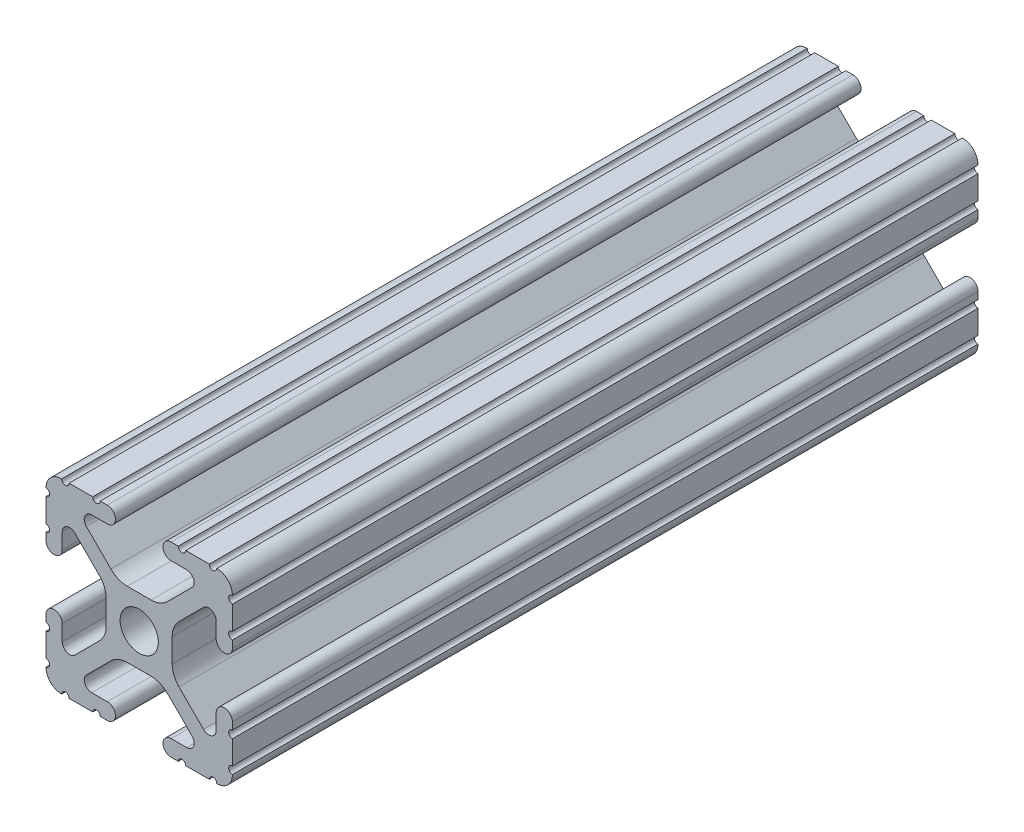
from build123d import *

# Parameters (mm, degrees)
SKETCH1_R           = 2.6035
BOSS_EXTRUDE1_DEPTH = 101.6


with BuildPart() as part:
    # Sketch1 → Boss-Extrude1 (new body)
    with BuildSketch(Plane(origin=(0, 0, -2463.8), x_dir=(-1, 0, 0), z_dir=(0, 0, -1))):
        with BuildLine():
            Line((12.7, -9.5504), (12.7, -6.3330836))
            ThreePointArc((12.7, -6.3330836), (12.192, -5.8250836), (12.7, -5.3170836))
            Line((12.7, -5.3170836), (12.7, -4.3434))
            ThreePointArc((12.7, -4.3434), (11.5951, -3.2385), (10.4902, -4.3434))
            Line((10.4902, -4.3434), (10.4902, -6.474794456))
            ThreePointArc((10.4902, -6.474794456), (9.863006367, -7.413456061), (8.75577951, -7.193214945))
            Line((8.75577951, -7.193214945), (5.42573597, -3.863171405))
            ThreePointArc((5.42573597, -3.863171405), (4.737482484, -2.833127272), (4.4958, -1.618107374))
            Line((4.4958, -1.618107374), (4.4958, 1.618107374))
            ThreePointArc((4.4958, 1.618107374), (4.737482484, 2.833127272), (5.42573597, 3.863171405))
            Line((5.42573597, 3.863171405), (8.75577951, 7.193214945))
            ThreePointArc((8.75577951, 7.193214945), (9.863006367, 7.413456061), (10.4902, 6.474794456))
            Line((10.4902, 6.474794456), (10.4902, 4.343399971))
            ThreePointArc((10.4902, 4.343399971), (11.5951, 3.238499971), (12.7, 4.343399971))
            Line((12.7, 4.343399971), (12.7, 5.3170836))
            ThreePointArc((12.7, 5.3170836), (12.192, 5.8250836), (12.7, 6.3330836))
            Line((12.7, 6.3330836), (12.7, 9.5504))
            ThreePointArc((12.7, 9.5504), (12.192000006, 10.058323491), (12.699846982, 10.566399977))
            ThreePointArc((12.699846982, 10.566399977), (12.082522516, 12.082522516), (10.566399977, 12.699846982))
            ThreePointArc((10.566399977, 12.699846982), (10.058323491, 12.192000006), (9.5504, 12.7))
            Line((9.5504, 12.7), (6.3330836, 12.7))
            ThreePointArc((6.3330836, 12.7), (5.8250836, 12.192), (5.3170836, 12.7))
            Line((5.3170836, 12.7), (4.3434, 12.7))
            ThreePointArc((4.3434, 12.7), (3.2385, 11.5951), (4.3434, 10.4902))
            Line((4.3434, 10.4902), (6.474794456, 10.4902))
            ThreePointArc((6.474794456, 10.4902), (7.413456061, 9.863006367), (7.193214945, 8.75577951))
            Line((7.193214945, 8.75577951), (3.863171405, 5.42573597))
            ThreePointArc((3.863171405, 5.42573597), (2.833127272, 4.737482484), (1.618107374, 4.4958))
            Line((1.618107374, 4.4958), (-1.618107374, 4.4958))
            ThreePointArc((-1.618107374, 4.4958), (-2.833127272, 4.737482484), (-3.863171405, 5.42573597))
            Line((-3.863171405, 5.42573597), (-7.193214945, 8.75577951))
            ThreePointArc((-7.193214945, 8.75577951), (-7.413456061, 9.863006367), (-6.474794456, 10.4902))
            Line((-6.474794456, 10.4902), (-4.343399971, 10.4902))
            ThreePointArc((-4.343399971, 10.4902), (-3.238499971, 11.5951), (-4.343399971, 12.7))
            Line((-4.343399971, 12.7), (-5.3170836, 12.7))
            ThreePointArc((-5.3170836, 12.7), (-5.8250836, 12.192), (-6.3330836, 12.7))
            Line((-6.3330836, 12.7), (-9.5504, 12.7))
            ThreePointArc((-9.5504, 12.7), (-10.058323491, 12.192000006), (-10.566399977, 12.699846982))
            ThreePointArc((-10.566399977, 12.699846982), (-12.082522516, 12.082522516), (-12.699846982, 10.566399977))
            ThreePointArc((-12.699846982, 10.566399977), (-12.192000006, 10.058323491), (-12.7, 9.5504))
            Line((-12.7, 9.5504), (-12.7, 6.3330836))
            ThreePointArc((-12.7, 6.3330836), (-12.192, 5.8250836), (-12.7, 5.3170836))
            Line((-12.7, 5.3170836), (-12.7, 4.3434))
            ThreePointArc((-12.7, 4.3434), (-11.5951, 3.2385), (-10.4902, 4.3434))
            Line((-10.4902, 4.3434), (-10.4902, 6.474794456))
            ThreePointArc((-10.4902, 6.474794456), (-9.863006367, 7.413456061), (-8.75577951, 7.193214945))
            Line((-8.75577951, 7.193214945), (-5.42573597, 3.863171405))
            ThreePointArc((-5.42573597, 3.863171405), (-4.737482484, 2.833127272), (-4.4958, 1.618107374))
            Line((-4.4958, 1.618107374), (-4.4958, -1.618107374))
            ThreePointArc((-4.4958, -1.618107374), (-4.737482484, -2.833127272), (-5.42573597, -3.863171405))
            Line((-5.42573597, -3.863171405), (-8.75577951, -7.193214945))
            ThreePointArc((-8.75577951, -7.193214945), (-9.863006367, -7.413456061), (-10.4902, -6.474794456))
            Line((-10.4902, -6.474794456), (-10.4902, -4.343399971))
            ThreePointArc((-10.4902, -4.343399971), (-11.5951, -3.238499971), (-12.7, -4.343399971))
            Line((-12.7, -4.343399971), (-12.7, -5.3170836))
            ThreePointArc((-12.7, -5.3170836), (-12.192, -5.8250836), (-12.7, -6.3330836))
            Line((-12.7, -6.3330836), (-12.7, -9.5504))
            ThreePointArc((-12.7, -9.5504), (-12.192000006, -10.058323491), (-12.699846982, -10.566399977))
            ThreePointArc((-12.699846982, -10.566399977), (-12.082522516, -12.082522516), (-10.566399977, -12.699846982))
            ThreePointArc((-10.566399977, -12.699846982), (-10.058323491, -12.192000006), (-9.5504, -12.7))
            Line((-9.5504, -12.7), (-6.3330836, -12.7))
            ThreePointArc((-6.3330836, -12.7), (-5.8250836, -12.192), (-5.3170836, -12.7))
            Line((-5.3170836, -12.7), (-4.3434, -12.7))
            ThreePointArc((-4.3434, -12.7), (-3.2385, -11.5951), (-4.3434, -10.4902))
            Line((-4.3434, -10.4902), (-6.474794456, -10.4902))
            ThreePointArc((-6.474794456, -10.4902), (-7.413456061, -9.863006367), (-7.193214945, -8.75577951))
            Line((-7.193214945, -8.75577951), (-3.863171405, -5.42573597))
            ThreePointArc((-3.863171405, -5.42573597), (-2.833127272, -4.737482484), (-1.618107374, -4.4958))
            Line((-1.618107374, -4.4958), (1.618107374, -4.4958))
            ThreePointArc((1.618107374, -4.4958), (2.833127272, -4.737482484), (3.863171405, -5.42573597))
            Line((3.863171405, -5.42573597), (7.193214945, -8.75577951))
            ThreePointArc((7.193214945, -8.75577951), (7.413456061, -9.863006367), (6.474794456, -10.4902))
            Line((6.474794456, -10.4902), (4.343399971, -10.4902))
            ThreePointArc((4.343399971, -10.4902), (3.238499971, -11.5951), (4.343399971, -12.7))
            Line((4.343399971, -12.7), (5.3170836, -12.7))
            ThreePointArc((5.3170836, -12.7), (5.8250836, -12.192), (6.3330836, -12.7))
            Line((6.3330836, -12.7), (9.5504, -12.7))
            ThreePointArc((9.5504, -12.7), (10.058323491, -12.192000006), (10.566399977, -12.699846982))
            ThreePointArc((10.566399977, -12.699846982), (12.082522516, -12.082522516), (12.699846982, -10.566399977))
            ThreePointArc((12.699846982, -10.566399977), (12.192000006, -10.058323491), (12.7, -9.5504))
        make_face()
        with Locations(Location((0, 0, 0), (0, 0, 180))):
            Circle(SKETCH1_R, mode=Mode.SUBTRACT)
    extrude(amount=BOSS_EXTRUDE1_DEPTH)


solid = part.part
